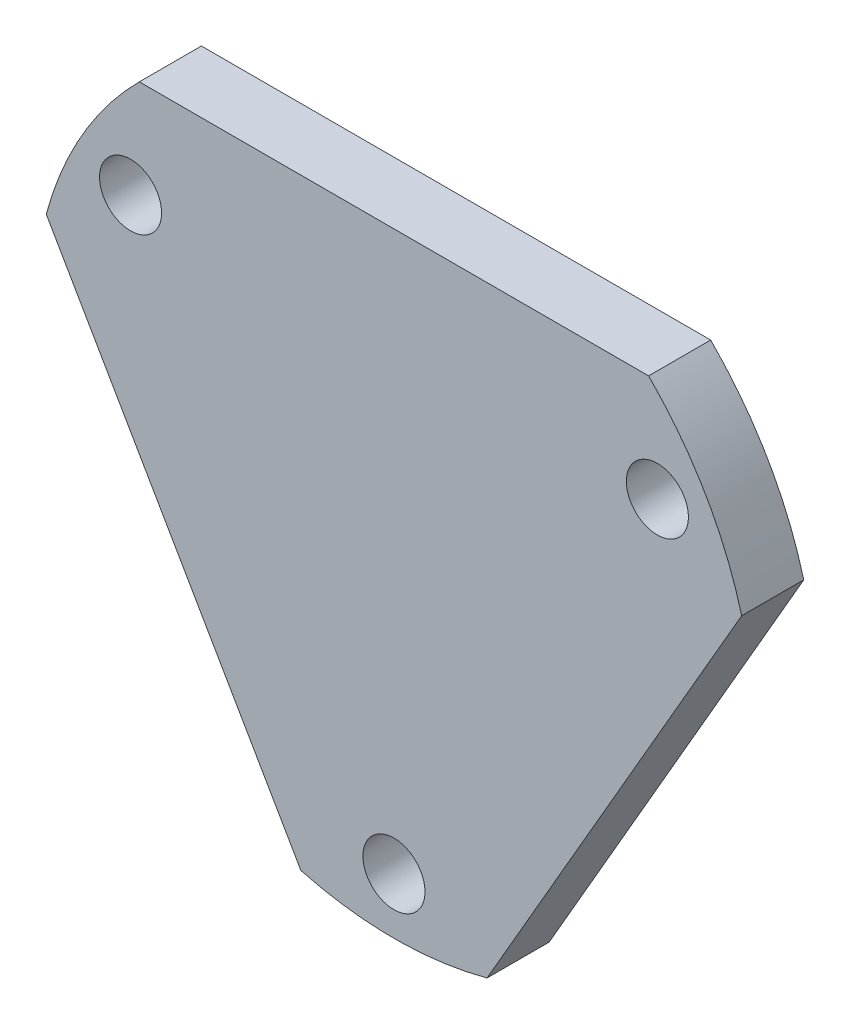
from build123d import *

# Parameters (mm, degrees)
SKETCH_1_R      = 1.25
EXTRUDE_1_DEPTH = 2.5


with BuildPart() as part:
    # Эскиз1 → Бобышка-Вытянуть1 (new body)
    with BuildSketch(Plane(origin=(0, 0, 0), x_dir=(1, 0, 0), z_dir=(0, 0, -1))):
        with BuildLine():
            Line((-10.256095748, -10.25), (10.256095748, -10.25))
            ThreePointArc((10.256095748, -10.25), (12.557368355, -7.25), (14.004808263, -3.757039462))
            Line((14.004808263, -3.757039462), (3.748712515, 14.007039462))
            ThreePointArc((3.748712515, 14.007039462), (0, 14.5), (-3.748712515, 14.007039462))
            Line((-3.748712515, 14.007039462), (-14.004808263, -3.757039462))
            ThreePointArc((-14.004808263, -3.757039462), (-12.557368355, -7.25), (-10.256095748, -10.25))
        make_face()
        with Locations(Location((0, 12.25, 0), (0, 0, 180))):
            Circle(SKETCH_1_R, mode=Mode.SUBTRACT)
        with Locations(Location((10.608811196, -6.125, 0), (0, 0, 180))):
            Circle(SKETCH_1_R, mode=Mode.SUBTRACT)
        with Locations(Location((-10.608811196, -6.125, 0), (0, 0, 180))):
            Circle(SKETCH_1_R, mode=Mode.SUBTRACT)
    extrude(amount=EXTRUDE_1_DEPTH)


solid = part.part
